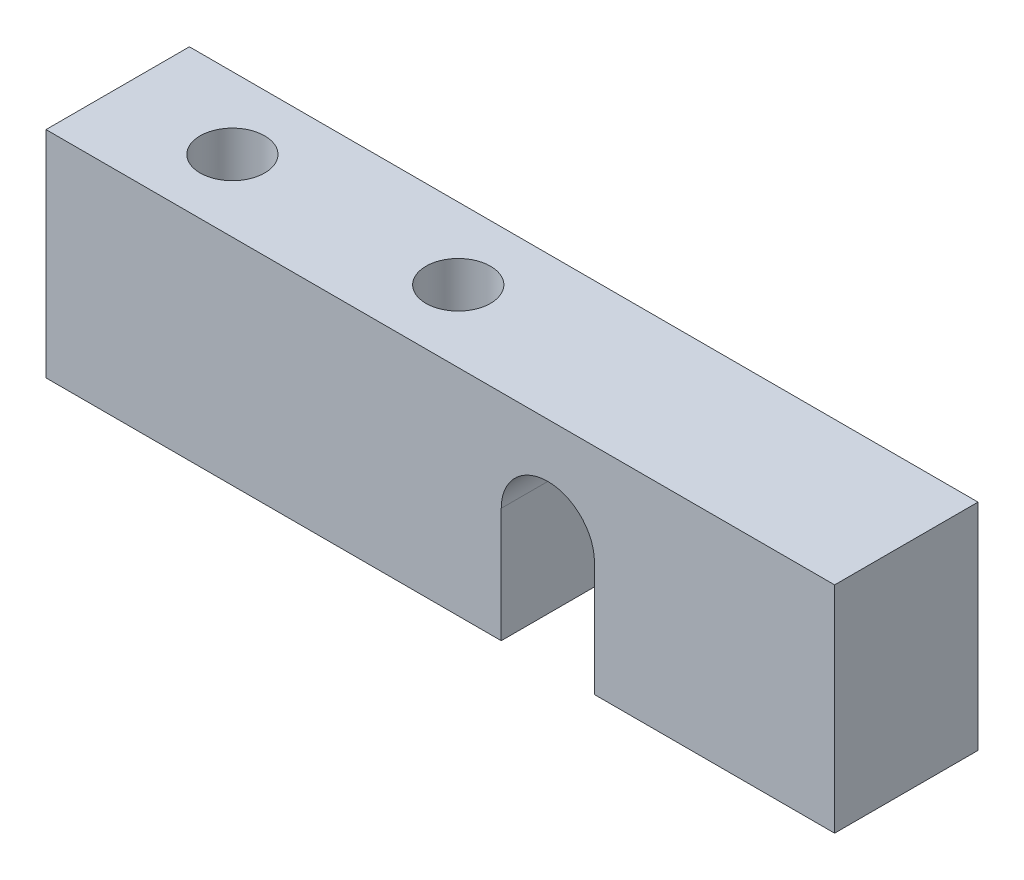
from build123d import *

# Parameters (mm, degrees)
SKIZZE1_W                                            = 55
SKIZZE1_H                                            = 10
AUFSATZ_LINEAR_AUSTRAGEN1_DEPTH                      = 15
SCHNITT_LINEAR_AUSTRAGEN1_DEPTH                      = 15
SKIZZE3_R                                            = 1
SCHNITT_LINEAR_AUSTRAGEN2_DEPTH                      = 20
FORMSENKUNG_F_R_M4_SENKSCHRAUBE_MIT_INNE_D           = 4.5
FORMSENKUNG_F_R_M4_SENKSCHRAUBE_MIT_INNE_DEPTH       = 21.5
FORMSENKUNG_F_R_M4_SENKSCHRAUBE_MIT_INNE_CSINK_D     = 9.18
FORMSENKUNG_F_R_M4_SENKSCHRAUBE_MIT_INNE_CSINK_ANGLE = 90
FORMSENKUNG_F_R_M4_SENKSCHRAUBE_MIT_INNE_TIP         = 1.351936393


with BuildPart() as part:
    # Skizze1 → Aufsatz-Linear austragen1 (new body)
    with BuildSketch(Plane(origin=(0, 0, 0), x_dir=(1, 0, 0), z_dir=(0, 1, 0))):
        with Locations((-11.047495286, -11.601305052)):
            Rectangle(SKIZZE1_W, SKIZZE1_H)
    extrude(amount=AUFSATZ_LINEAR_AUSTRAGEN1_DEPTH)

    # Skizze2 → Schnitt-Linear austragen1 (cut)
    with BuildSketch(Plane(origin=(0, 0, 6.601305052), x_dir=(-1, 0, 0), z_dir=(0, 0, -1))):
        with BuildLine():
            Line((0.297495286, 8), (0.297495286, 0))
            Line((0.297495286, 0), (6.797495286, 0))
            Line((6.797495286, 0), (6.797495286, 8))
            ThreePointArc((6.797495286, 8), (3.547495286, 11.25), (0.297495286, 8))
        make_face()
    extrude(amount=-SCHNITT_LINEAR_AUSTRAGEN1_DEPTH, mode=Mode.SUBTRACT)

    # Skizze3 → Schnitt-Linear austragen2 (cut)
    with BuildSketch(Plane.XZ):
        with Locations(Location((-14.797495286, 11.601305052, 0), (0, 0, 270))):
            Circle(SKIZZE3_R)
        with Locations(Location((-30.547495286, 11.601305052, 0), (0, 0, 270))):
            Circle(SKIZZE3_R)
    extrude(amount=-SCHNITT_LINEAR_AUSTRAGEN2_DEPTH, mode=Mode.SUBTRACT)

    # Formsenkung für M4 Senkschraube mit Innensechskant1
    with Locations(Plane(origin=(-30.547495286, 0, 11.601305052), x_dir=(0, 0, -1), z_dir=(0, -1, 0))):
        with Locations((0, 0), (0, 15.75)):
            CounterSinkHole(FORMSENKUNG_F_R_M4_SENKSCHRAUBE_MIT_INNE_D / 2, FORMSENKUNG_F_R_M4_SENKSCHRAUBE_MIT_INNE_CSINK_D / 2, depth=FORMSENKUNG_F_R_M4_SENKSCHRAUBE_MIT_INNE_DEPTH, counter_sink_angle=FORMSENKUNG_F_R_M4_SENKSCHRAUBE_MIT_INNE_CSINK_ANGLE)
            with Locations((0, 0, -(FORMSENKUNG_F_R_M4_SENKSCHRAUBE_MIT_INNE_DEPTH + FORMSENKUNG_F_R_M4_SENKSCHRAUBE_MIT_INNE_TIP / 2))):  # 118° drill point
                Cone(0, FORMSENKUNG_F_R_M4_SENKSCHRAUBE_MIT_INNE_D / 2, FORMSENKUNG_F_R_M4_SENKSCHRAUBE_MIT_INNE_TIP, mode=Mode.SUBTRACT)


solid = part.part
